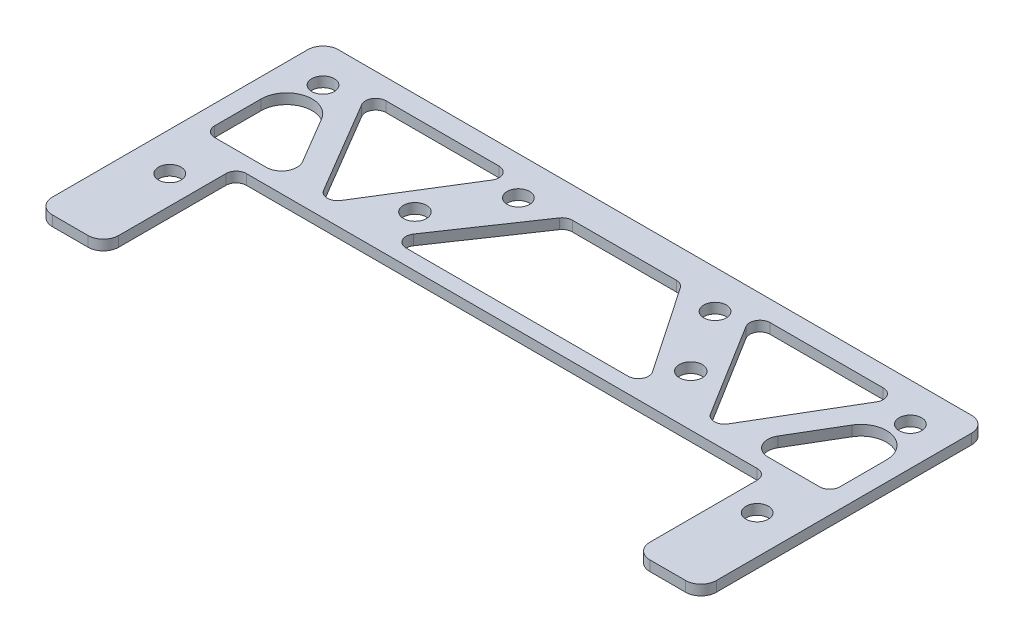
from build123d import *

# Parameters (mm, degrees)
SKETCH_1_W          = 13
SKETCH_1_H          = 22
SKETCH_1_R          = 2.2
SKETCH_1_H_2        = 19
SKETCH_1_H_3        = 15
SKETCH_1_W_2        = 104
EXTRUDE_3_DEPTH     = 2
SKETCH_2_R          = 2.25
CUT_EXTRUDE_1_DEPTH = 10
CUT_EXTRUDE_2_DEPTH = 10
SKETCH_4_W          = 104
SKETCH_4_H          = 4
CUT_EXTRUDE_3_DEPTH = 10
FILLET_1_R          = 2
FILLET_2_R          = 3


with BuildPart() as part:
    # 草图1 → 凸台-拉伸3 (new body)
    # profile 1 of 8: a face of its own
    with BuildSketch(Plane(origin=(0, 0, 0), x_dir=(1, 0, 0), z_dir=(0, 1, 0))):
        with Locations((6.5, -45)):
            Rectangle(SKETCH_1_W, SKETCH_1_H)
        with Locations(Location((7.5, -37.5, 0), (0, 0, 270))):
            Circle(SKETCH_1_R, mode=Mode.SUBTRACT)
    # profile 2 of 8: a face of its own
    with BuildSketch(Plane(origin=(0, 0, 0), x_dir=(1, 0, 0), z_dir=(0, 1, 0))):
        with Locations((6.5, -24.5)):
            Rectangle(SKETCH_1_W, SKETCH_1_H_2)
    # profile 3 of 8: a face of its own
    with BuildSketch(Plane(origin=(0, 0, 0), x_dir=(1, 0, 0), z_dir=(0, 1, 0))):
        with Locations((6.5, -7.5)):
            Rectangle(SKETCH_1_W, SKETCH_1_H_3)
        with Locations(Location((7.5, -7.5, 0), (0, 0, 270))):
            Circle(SKETCH_1_R, mode=Mode.SUBTRACT)
    # profile 4 of 8: a face of its own
    with BuildSketch(Plane(origin=(0, 0, 0), x_dir=(1, 0, 0), z_dir=(0, 1, 0))):
        with Locations((65, -7.5)):
            Rectangle(SKETCH_1_W_2, SKETCH_1_H_3)
        with Locations(Location((45.75, -7.5, 0), (0, 0, 270))):
            Circle(SKETCH_1_R, mode=Mode.SUBTRACT)
        with Locations(Location((84.25, -7.5, 0), (0, 0, 270))):
            Circle(SKETCH_1_R, mode=Mode.SUBTRACT)
    # profile 5 of 8: a face of its own
    with BuildSketch(Plane(origin=(0, 0, 0), x_dir=(1, 0, 0), z_dir=(0, 1, 0))):
        with Locations((123.5, -7.5)):
            Rectangle(SKETCH_1_W, SKETCH_1_H_3)
        with Locations(Location((122.5, -7.5, 0), (0, 0, 270))):
            Circle(SKETCH_1_R, mode=Mode.SUBTRACT)
    # profile 6 of 8: a face of its own
    with BuildSketch(Plane(origin=(0, 0, 0), x_dir=(1, 0, 0), z_dir=(0, 1, 0))):
        with Locations((123.5, -24.5)):
            Rectangle(SKETCH_1_W, SKETCH_1_H_2)
    # profile 7 of 8: a face of its own
    with BuildSketch(Plane(origin=(0, 0, 0), x_dir=(1, 0, 0), z_dir=(0, 1, 0))):
        with Locations((123.5, -45)):
            Rectangle(SKETCH_1_W, SKETCH_1_H)
        with Locations(Location((122.5, -37.5, 0), (0, 0, 270))):
            Circle(SKETCH_1_R, mode=Mode.SUBTRACT)
    # profile 8 of 8: a face of its own
    with BuildSketch(Plane(origin=(0, 0, 0), x_dir=(1, 0, 0), z_dir=(0, 1, 0))):
        with Locations((65, -24.5)):
            Rectangle(SKETCH_1_W_2, SKETCH_1_H_2)
    extrude(amount=EXTRUDE_3_DEPTH)

    # 草图2 → 切除-拉伸1 (cut)
    with BuildSketch(Plane(origin=(0, 2, 0), x_dir=(1, 0, 0), z_dir=(0, 1, 0))):
        with Locations(Location((38, -20, 0), (0, 0, 270))):
            Circle(SKETCH_2_R)
        with Locations(Location((92, -20, 0), (0, 0, 270))):
            Circle(SKETCH_2_R)
    extrude(amount=-CUT_EXTRUDE_1_DEPTH, mode=Mode.SUBTRACT)

    # 草图3 → 切除-拉伸2 (cut)
    with BuildSketch(Plane(origin=(0, 2, 0), x_dir=(1, 0, 0), z_dir=(0, 1, 0))):
        with BuildLine():
            ThreePointArc((38.443762995, -4), (40.191298213, -5.02731266), (40.143568379, -7.053879338))
            Line((40.143568379, -7.053879338), (28.817131634, -25.3223257))
            ThreePointArc((28.817131634, -25.3223257), (27.096125533, -26.268333991), (25.39556113, -25.286053787))
            Line((25.39556113, -25.286053787), (14.598439949, -7.017607424))
            ThreePointArc((14.598439949, -7.017607424), (14.583078872, -5.00884281), (16.320205069, -4))
            Line((16.320205069, -4), (38.443762995, -4))
        make_face()
        with BuildLine():
            Line((3.788738097, -15.906719656), (3.788738097, -25))
            ThreePointArc((3.788738097, -25), (4.374524535, -26.414213562), (5.788738097, -27))
            Line((5.788738097, -27), (15.89527198, -27))
            ThreePointArc((15.89527198, -27), (18.500961276, -25.486735785), (18.477919661, -22.473588863))
            Line((18.477919661, -22.473588863), (13.093150898, -13.362701095))
            ThreePointArc((13.093150898, -13.362701095), (7.470038739, -11.083750445), (3.788738097, -15.906719656))
        make_face()
        with BuildLine():
            Line((65, -27), (65, -6))
            Line((65, -6), (54.809846331, -6))
            ThreePointArc((54.809846331, -6), (53.873365064, -6.23279802), (53.154894782, -6.876997163))
            Line((53.154894782, -6.876997163), (41.619180496, -23.876997163))
            ThreePointArc((41.619180496, -23.876997163), (41.506930066, -25.936481267), (43.274132045, -27))
            Line((43.274132045, -27), (65, -27))
        make_face()
        with BuildLine():
            Line((75.190153669, -6), (65, -6))
            Line((65, -6), (65, -27))
            Line((65, -27), (86.725867955, -27))
            ThreePointArc((86.725867955, -27), (88.493069934, -25.936481267), (88.380819504, -23.876997163))
            Line((88.380819504, -23.876997163), (76.845105218, -6.876997163))
            ThreePointArc((76.845105218, -6.876997163), (76.126634936, -6.23279802), (75.190153669, -6))
        make_face()
        with BuildLine():
            Line((89.856431621, -7.053879338), (101.182868366, -25.3223257))
            ThreePointArc((101.182868366, -25.3223257), (102.903874467, -26.268333991), (104.60443887, -25.286053787))
            Line((104.60443887, -25.286053787), (115.401560051, -7.017607424))
            ThreePointArc((115.401560051, -7.017607424), (115.416921128, -5.00884281), (113.679794931, -4))
            Line((113.679794931, -4), (91.556237005, -4))
            ThreePointArc((91.556237005, -4), (89.808701787, -5.02731266), (89.856431621, -7.053879338))
        make_face()
        with BuildLine():
            ThreePointArc((126.211261903, -25), (125.625475465, -26.414213562), (124.211261903, -27))
            Line((124.211261903, -27), (114.10472802, -27))
            ThreePointArc((114.10472802, -27), (111.499038724, -25.486735785), (111.522080339, -22.473588863))
            Line((111.522080339, -22.473588863), (116.906849102, -13.362701095))
            ThreePointArc((116.906849102, -13.362701095), (122.529961261, -11.083750445), (126.211261903, -15.906719656))
            Line((126.211261903, -15.906719656), (126.211261903, -25))
        make_face()
    extrude(amount=-CUT_EXTRUDE_2_DEPTH, mode=Mode.SUBTRACT)

    # 草图4 → 切除-拉伸3 (cut)
    with BuildSketch(Plane(origin=(0, 2, 0), x_dir=(1, 0, 0), z_dir=(0, 1, 0))):
        with Locations((65, -32)):
            Rectangle(SKETCH_4_W, SKETCH_4_H)
    extrude(amount=-CUT_EXTRUDE_3_DEPTH, mode=Mode.SUBTRACT)

    # 圆角1
    fillet_1_edges = [part.edges().sort_by_distance(p)[0] for p in [
        (13, 1, 30),
        (117, 1, 30),
    ]]
    fillet(fillet_1_edges, radius=FILLET_1_R)

    # 圆角2
    fillet_2_edges = [part.edges().sort_by_distance(p)[0] for p in [
        (130, 1, 56),
        (117, 1, 56),
        (13, 1, 56),
        (0, 1, 56),
        (0, 1, 0),
        (130, 1, 0),
    ]]
    fillet(fillet_2_edges, radius=FILLET_2_R)


solid = part.part
